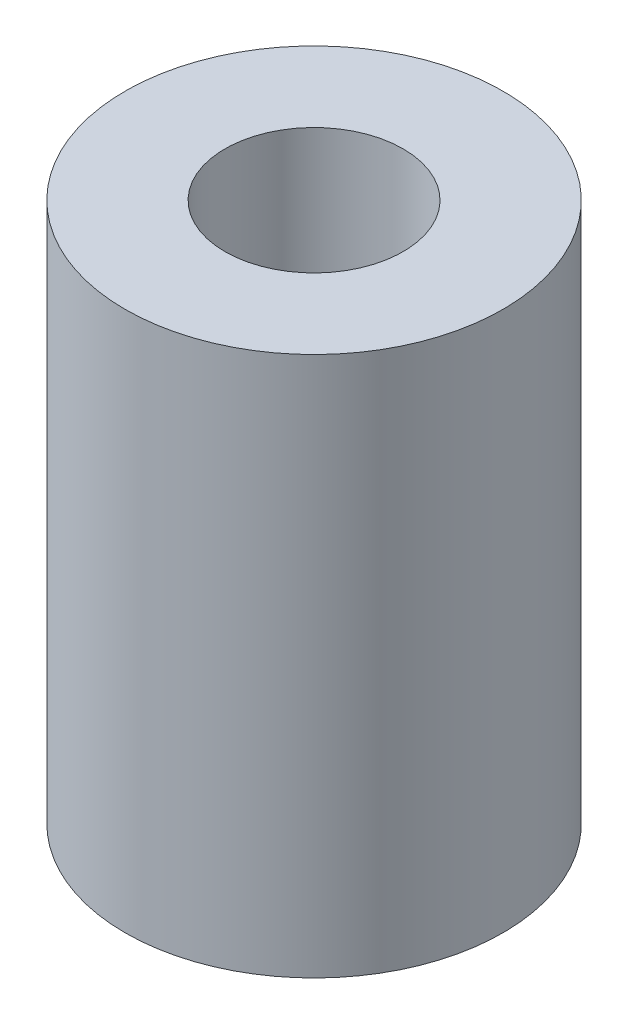
from build123d import *

# Parameters (mm, degrees)
SKETCH1_R           = 3.5
BOSS_EXTRUDE1_DEPTH = 10
SKETCH2_R           = 1.65
CUT_EXTRUDE1_DEPTH  = 12.157956802


with BuildPart() as part:
    # Sketch1 → Boss-Extrude1 (new body)
    with BuildSketch(Plane(origin=(0, 0, 0), x_dir=(1, 0, 0), z_dir=(0, 1, 0))):
        with Locations(Location((0, 0, 0), (0, 0, 270))):
            Circle(SKETCH1_R)
    extrude(amount=BOSS_EXTRUDE1_DEPTH)

    # Sketch2 → Cut-Extrude1 (cut, through all)
    with BuildSketch(Plane(origin=(0, 10, 0), x_dir=(1, 0, 0), z_dir=(0, 1, 0))):
        with Locations(Location((0, 0, 0), (0, 0, 270))):
            Circle(SKETCH2_R)
    extrude(amount=-CUT_EXTRUDE1_DEPTH, mode=Mode.SUBTRACT)


solid = part.part
